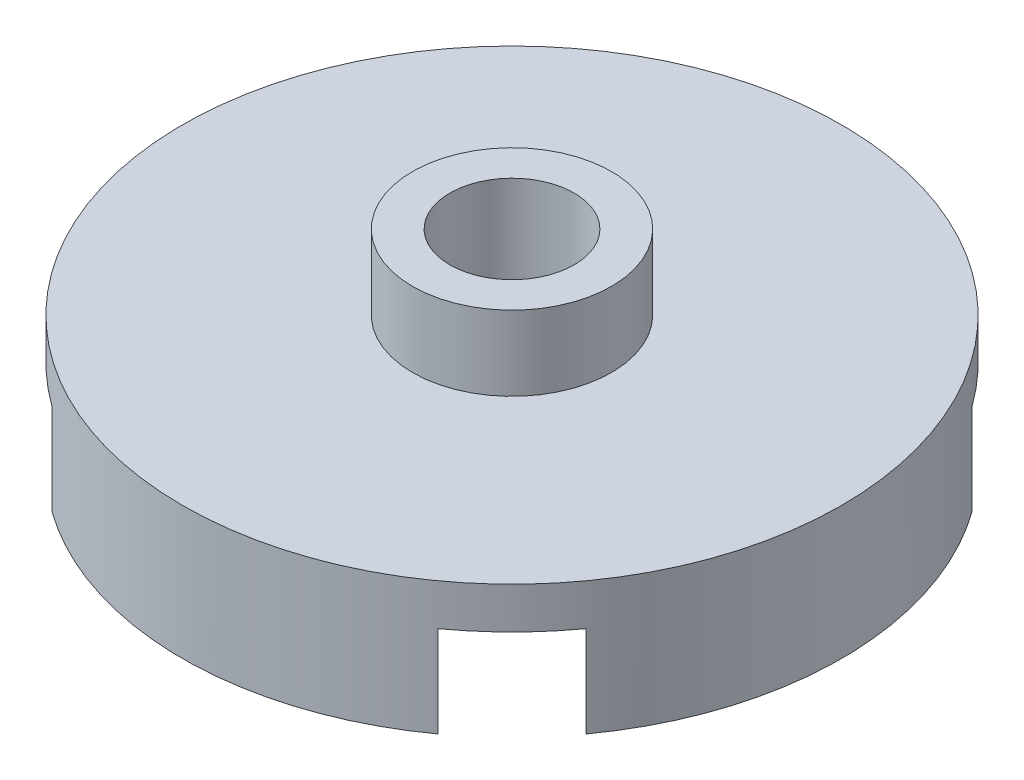
from build123d import *

# Parameters (mm, degrees)
SKETCH1_R           = 7.95
BOSS_EXTRUDE1_DEPTH = 3.2
SKETCH2_R           = 2.4
BOSS_EXTRUDE2_DEPTH = 1.8
SHELL1_T            = -1
BOSS_EXTRUDE3_START = 2.2
SKETCH3_R           = 3.3
SKETCH3_R_2         = 2.4
BOSS_EXTRUDE3_DEPTH = 2.2
SKETCH4_R           = 2.45
CUT_EXTRUDE1_DEPTH  = 12.586414458
CIRPATTERN2_COUNT   = 4
SKETCH5_R           = 1.5
CUT_EXTRUDE2_DEPTH  = 13.304673909


with BuildPart() as part:
    # Sketch1 → Boss-Extrude1 (new body)
    with BuildSketch(Plane(origin=(0, 0, 0), x_dir=(1, 0, 0), z_dir=(0, 1, 0))):
        with Locations(Location((0, 0, 0), (0, 0, 270))):
            Circle(SKETCH1_R)
    extrude(amount=BOSS_EXTRUDE1_DEPTH)

    # Sketch2 → Boss-Extrude2 (add)
    with BuildSketch(Plane(origin=(0, 3.2, 0), x_dir=(1, 0, 0), z_dir=(0, 1, 0))):
        with Locations(Location((0, 0, 0), (0, 0, 270))):
            Circle(SKETCH2_R)
    extrude(amount=BOSS_EXTRUDE2_DEPTH)

    # Shell1
    shell1_openings = [part.faces().sort_by_distance(p)[0] for p in [
        (0, 0, 0),
    ]]
    offset(amount=SHELL1_T, openings=shell1_openings, kind=Kind.INTERSECTION)

    # Sketch3 → Boss-Extrude3 (add)
    with BuildSketch(Plane.XZ.offset(-2.2).offset(BOSS_EXTRUDE3_START)):
        with Locations(Location((0, 0, 0), (0, 0, 90))):
            Circle(SKETCH3_R)
        with Locations(Location((0, 0, 0), (0, 0, 90))):
            Circle(SKETCH3_R_2, mode=Mode.SUBTRACT)
    extrude(amount=-BOSS_EXTRUDE3_DEPTH)

    # Sketch4 → Cut-Extrude1 (cut, through all)
    with BuildSketch(Plane.XZ.offset(-2.2)):
        with Locations((-4.065863992, -4.065863992)):
            Circle(SKETCH4_R)
    cut_extrude1 = extrude(amount=CUT_EXTRUDE1_DEPTH, mode=Mode.SUBTRACT)

    # CirPattern2: Cut-Extrude1 ×4 about axis
    cirpattern2_axis = Axis((0, 0, 0), (0, 1, 0))
    for i in range(1, CIRPATTERN2_COUNT):
        add(cut_extrude1.rotate(cirpattern2_axis, i * 360 / CIRPATTERN2_COUNT), mode=Mode.SUBTRACT)

    # Sketch5 → Cut-Extrude2 (cut, through all)
    with BuildSketch(Plane(origin=(0, 5, 0), x_dir=(1, 0, 0), z_dir=(0, 1, 0))):
        with Locations(Location((0, 0, 0), (0, 0, 270))):
            Circle(SKETCH5_R)
    extrude(amount=-CUT_EXTRUDE2_DEPTH, mode=Mode.SUBTRACT)


solid = part.part
